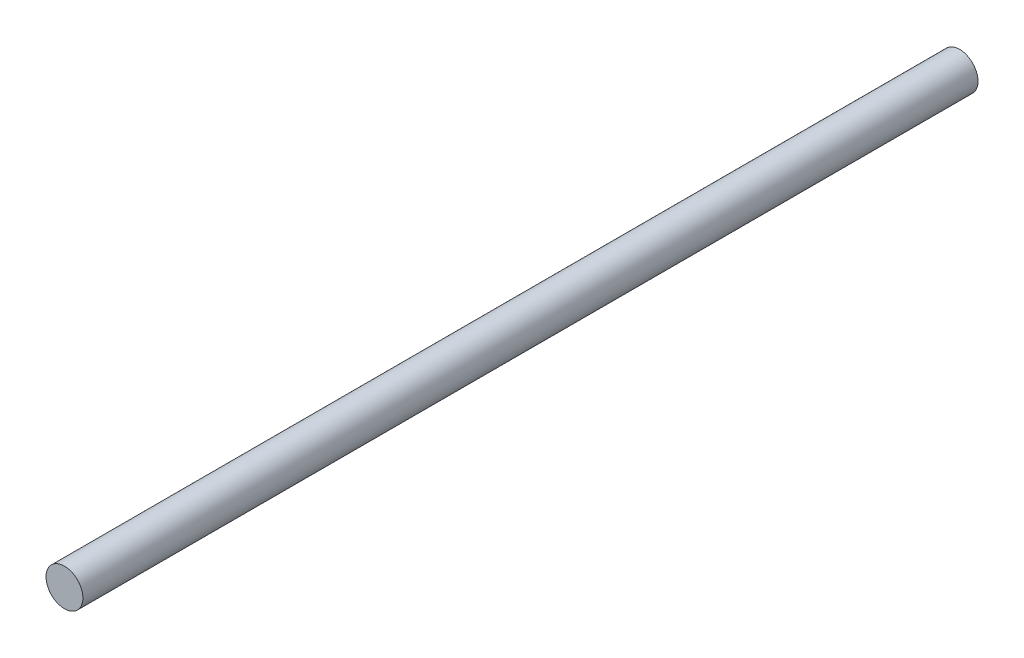
from build123d import *

# Parameters (mm, degrees)
SKETCH1_R           = 4
BOSS_EXTRUDE1_DEPTH = 194


with BuildPart() as part:
    # Sketch1 → Boss-Extrude1 (new body)
    with BuildSketch(Plane.XY):
        with Locations(Location((0, 0, 0), (0, 0, 180))):
            Circle(SKETCH1_R)
    extrude(amount=BOSS_EXTRUDE1_DEPTH)


solid = part.part
